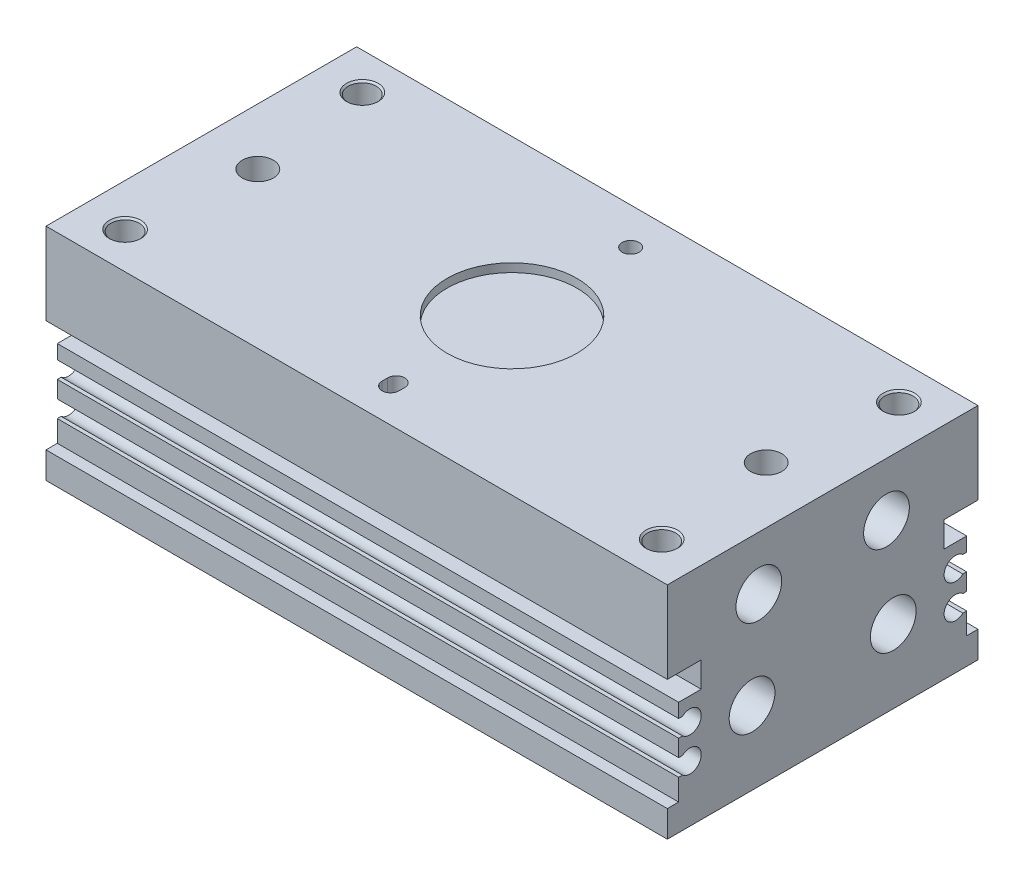
from build123d import *

# Parameters (mm, degrees)
SKETCH2_W                = 55
SKETCH2_H                = 39
BOSS_EXTRUDE1_DEPTH      = 55
CUT_EXTRUDE1_DEPTH       = 65.509689195
CUT_EXTRUDE1_DEPTH_BACK  = 65.509689195
SKETCH3_W                = 2
SKETCH3_H                = 19.8
CUT_EXTRUDE2_DEPTH       = 65.509689195
CUT_EXTRUDE2_DEPTH_BACK  = 65.509689195
SKETCH7_R                = 2.5
CUT_EXTRUDE4_DEPTH       = 10
CHAMFER2_SIZE            = 0.3
SKETCH8_R                = 1.5
CUT_EXTRUDE5_DEPTH       = 3
SKETCH9_R                = 2.75
CUT_EXTRUDE6_DEPTH       = 73.816550317
SKETCH10_R               = 2.5
CUT_EXTRUDE7_DEPTH       = 6
CHAMFER3_SIZE            = 0.3
CUT_EXTRUDE8_DEPTH       = 65.509689195
CUT_EXTRUDE8_DEPTH_BACK  = 65.509689195
SKETCH11_R               = 4.05
SKETCH12_R               = 11.5
CUT_EXTRUDE9_DEPTH       = 1.5
SKETCH13_R               = 5
CUT_EXTRUDE10_DEPTH      = 22.5
CUT_EXTRUDE11_DEPTH      = 65.509689195
CUT_EXTRUDE11_DEPTH_BACK = 65.509689195
SKETCH14_W               = 6
SKETCH14_H               = 4.5


with BuildPart() as part:
    # Sketch2 → Boss-Extrude1 (new, symmetric)
    with BuildSketch(Plane(origin=(0, 0, 0), x_dir=(0, 0, -1), z_dir=(1, 0, 0))):
        Rectangle(SKETCH2_W, SKETCH2_H)
    extrude(amount=BOSS_EXTRUDE1_DEPTH, both=True)

    # Sketch3 → Cut-Extrude1 (cut, two sides: drawn at the far end of the back side and taken through both)
    with BuildSketch(Plane(origin=(0, 0, 0), x_dir=(0, 0, -1), z_dir=(1, 0, 0)).offset(-CUT_EXTRUDE1_DEPTH_BACK)):
        with Locations((-26.5, -4.9)):
            Rectangle(SKETCH3_W, SKETCH3_H)
        with Locations((26.5, -4.9)):
            Rectangle(SKETCH3_W, SKETCH3_H)
    extrude(amount=CUT_EXTRUDE1_DEPTH + CUT_EXTRUDE1_DEPTH_BACK, mode=Mode.SUBTRACT)

    # Sketch5 → Cut-Extrude2 (cut, two sides: drawn at the far end of the back side and taken through both)
    with BuildSketch(Plane(origin=(0, 0, 0), x_dir=(0, 0, -1), z_dir=(1, 0, 0)).offset(-CUT_EXTRUDE2_DEPTH_BACK)):
        with BuildLine():
            Line((-24.822875656, -2), (-25.5, -2))
            Line((-25.5, -2), (-25.5, -5))
            Line((-25.5, -5), (-24.822875656, -5))
            ThreePointArc((-24.822875656, -5), (-21.5, -3.5), (-24.822875656, -2))
        make_face()
        with BuildLine():
            Line((-24.822875656, -8), (-25.5, -8))
            Line((-25.5, -8), (-25.5, -11))
            Line((-25.5, -11), (-24.822875656, -11))
            ThreePointArc((-24.822875656, -11), (-21.5, -9.5), (-24.822875656, -8))
        make_face()
        with BuildLine():
            Line((25.5, -8), (25.5, -11))
            Line((25.5, -11), (24.822875656, -11))
            ThreePointArc((24.822875656, -11), (21.5, -9.5), (24.822875656, -8))
            Line((24.822875656, -8), (25.5, -8))
        make_face()
        with BuildLine():
            Line((25.5, -2), (25.5, -5))
            Line((25.5, -5), (24.822875656, -5))
            ThreePointArc((24.822875656, -5), (21.5, -3.5), (24.822875656, -2))
            Line((24.822875656, -2), (25.5, -2))
        make_face()
    extrude(amount=CUT_EXTRUDE2_DEPTH + CUT_EXTRUDE2_DEPTH_BACK, mode=Mode.SUBTRACT)

    # Sketch7 → Cut-Extrude4 (cut)
    with BuildSketch(Plane(origin=(0, 19.5, 0), x_dir=(1, 0, 0), z_dir=(0, 1, 0))):
        with Locations((-47.5, 21)):
            Circle(SKETCH7_R)
        with Locations((47.5, 21)):
            Circle(SKETCH7_R)
        with Locations((47.5, -21)):
            Circle(SKETCH7_R)
        with Locations((-47.5, -21)):
            Circle(SKETCH7_R)
    extrude(amount=-CUT_EXTRUDE4_DEPTH, mode=Mode.SUBTRACT)

    # Chamfer2
    chamfer2_edges = [part.edges().sort_by_distance(p)[0] for p in [
        (-50, 19.5, 21),
        (45, 19.5, 21),
        (45, 19.5, -21),
        (-50, 19.5, -21),
    ]]
    chamfer(chamfer2_edges, length=CHAMFER2_SIZE)

    # Sketch8 → Cut-Extrude5 (cut)
    with BuildSketch(Plane(origin=(0, 19.5, 0), x_dir=(1, 0, 0), z_dir=(0, 1, 0))):
        with Locations((0, 21)):
            Circle(SKETCH8_R)
        with BuildLine():
            Line((-1.5, -21.5), (-1.5, -20.5))
            ThreePointArc((-1.5, -20.5), (0, -19), (1.5, -20.5))
            Line((1.5, -20.5), (1.5, -21.5))
            ThreePointArc((1.5, -21.5), (0, -23), (-1.5, -21.5))
        make_face()
    extrude(amount=-CUT_EXTRUDE5_DEPTH, mode=Mode.SUBTRACT)

    # Sketch9 → Cut-Extrude6 (cut, through all)
    with BuildSketch(Plane(origin=(0, 19.5, 0), x_dir=(1, 0, 0), z_dir=(0, 1, 0))):
        with Locations((-45, 0)):
            Circle(SKETCH9_R)
        with Locations((45, 0)):
            Circle(SKETCH9_R)
    extrude(amount=-CUT_EXTRUDE6_DEPTH, mode=Mode.SUBTRACT)

    # Sketch10 → Cut-Extrude7 (cut)
    with BuildSketch(Plane(origin=(0, 0, -27.5), x_dir=(-1, 0, 0), z_dir=(0, 0, -1))):
        with Locations((-39, 9.5)):
            Circle(SKETCH10_R)
        with Locations((39, 9.5)):
            Circle(SKETCH10_R)
    extrude(amount=-CUT_EXTRUDE7_DEPTH, mode=Mode.SUBTRACT)

    # Chamfer3
    chamfer3_edges = [part.edges().sort_by_distance(p)[0] for p in [
        (-36.5, 9.5, -27.5),
        (41.5, 9.5, -27.5),
    ]]
    chamfer(chamfer3_edges, length=CHAMFER3_SIZE)

    # Sketch11 → Cut-Extrude8 (cut, two sides: drawn at the far end of the back side and taken through both)
    with BuildSketch(Plane(origin=(0, 0, 0), x_dir=(0, 0, -1), z_dir=(1, 0, 0)).offset(-CUT_EXTRUDE8_DEPTH_BACK)):
        with Locations((-11.3, 10)):
            Circle(SKETCH11_R)
        with Locations((11.3, 10)):
            Circle(SKETCH11_R)
        with Locations((-12.5, -6.5)):
            Circle(SKETCH11_R)
        with Locations((12.5, -6.5)):
            Circle(SKETCH11_R)
    extrude(amount=CUT_EXTRUDE8_DEPTH + CUT_EXTRUDE8_DEPTH_BACK, mode=Mode.SUBTRACT)

    # Sketch12 → Cut-Extrude9 (cut)
    with BuildSketch(Plane(origin=(0, 19.5, 0), x_dir=(1, 0, 0), z_dir=(0, 1, 0))):
        Circle(SKETCH12_R)
    extrude(amount=-CUT_EXTRUDE9_DEPTH, mode=Mode.SUBTRACT)

    # Sketch13 → Cut-Extrude10 (cut, symmetric)
    with BuildSketch(Plane(origin=(0, 0, 0), x_dir=(0, 0, -1), z_dir=(1, 0, 0))):
        with Locations((-11.3, 10)):
            Circle(SKETCH13_R)
        with Locations((11.3, 10)):
            Circle(SKETCH13_R)
        with Locations((12.5, -6.5)):
            Circle(SKETCH13_R)
        with Locations((-12.5, -6.5)):
            Circle(SKETCH13_R)
    extrude(amount=CUT_EXTRUDE10_DEPTH, both=True, mode=Mode.SUBTRACT)

    # Sketch14 → Cut-Extrude11 (cut, two sides: drawn at the far end of the back side and taken through both)
    with BuildSketch(Plane(origin=(0, 0, 0), x_dir=(0, 0, -1), z_dir=(1, 0, 0)).offset(-CUT_EXTRUDE11_DEPTH_BACK)):
        with Locations((-24.5, 2.75)):
            Rectangle(SKETCH14_W, SKETCH14_H)
        with Locations((24.5, 2.75)):
            Rectangle(SKETCH14_W, SKETCH14_H)
    extrude(amount=CUT_EXTRUDE11_DEPTH + CUT_EXTRUDE11_DEPTH_BACK, mode=Mode.SUBTRACT)


solid = part.part
